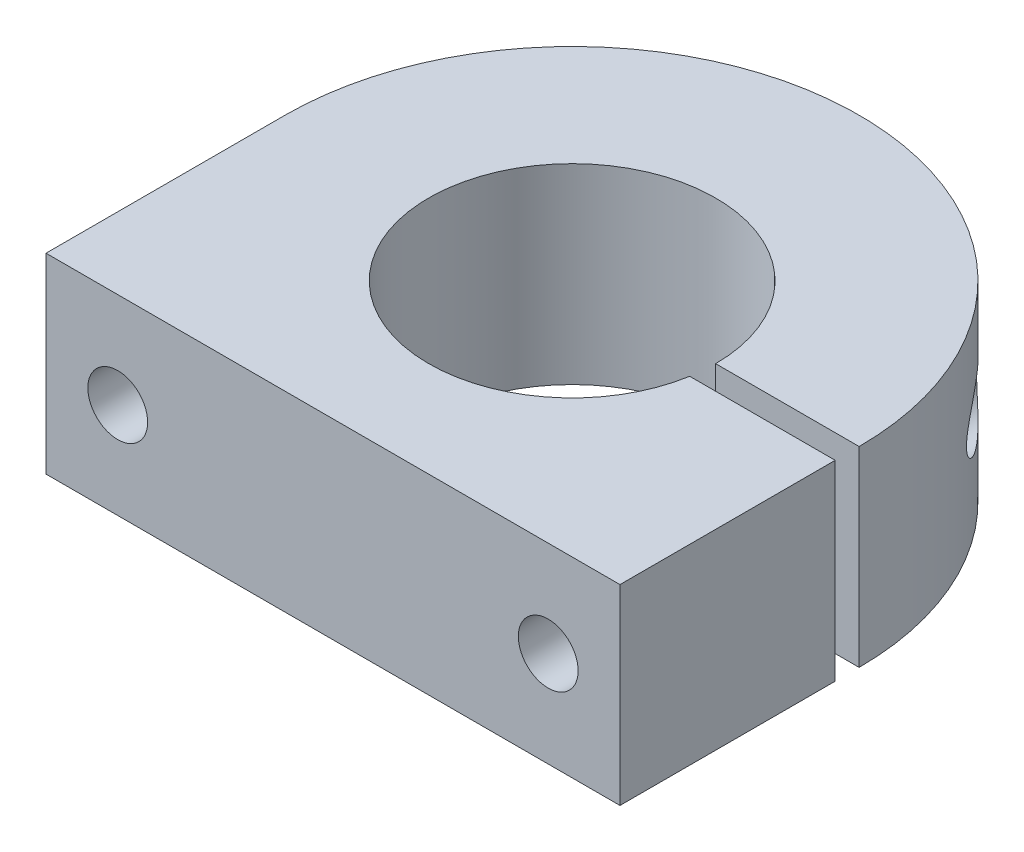
from build123d import *

# Parameters (mm, degrees)
BOSS_EXTRUDE1_DEPTH         = 8
SKETCH2_R                   = 6
CUT_EXTRUDE1_DEPTH          = 19.761663039
TAP_DRILL_FOR_M3X0_5_TAP1_D = 2.5
SKETCH6_W                   = 12
SKETCH6_H                   = 1
CUT_EXTRUDE2_DEPTH          = 8


with BuildPart() as part:
    # Sketch1 → Boss-Extrude1 (new body)
    with BuildSketch(Plane(origin=(0, 0, 0), x_dir=(1, 0, 0), z_dir=(0, 1, 0))):
        with BuildLine():
            Line((-12, -10), (12, -10))
            Line((12, -10), (12, 0))
            ThreePointArc((12, 0), (0, 12), (-12, 0))
            Line((-12, 0), (-12, -10))
        make_face()
    extrude(amount=BOSS_EXTRUDE1_DEPTH)

    # Sketch2 → Cut-Extrude1 (cut, through all)
    with BuildSketch(Plane(origin=(0, 8, 0), x_dir=(1, 0, 0), z_dir=(0, 1, 0))):
        with Locations(Location((0, 0, 0), (0, 0, 270))):
            Circle(SKETCH2_R)
    extrude(amount=-CUT_EXTRUDE1_DEPTH, mode=Mode.SUBTRACT)

    # Tap Drill for M3x0.5 Tap1 (through all)
    with Locations(Plane.XY.offset(10)):
        with Locations((-9, 4), (9, 4)):
            Hole(TAP_DRILL_FOR_M3X0_5_TAP1_D / 2)

    # Sketch6 → Cut-Extrude2 (cut)
    with BuildSketch(Plane(origin=(0, 8, 0), x_dir=(1, 0, 0), z_dir=(0, 1, 0))):
        with Locations((6, -0.5)):
            Rectangle(SKETCH6_W, SKETCH6_H)
    extrude(amount=-CUT_EXTRUDE2_DEPTH, mode=Mode.SUBTRACT)


solid = part.part
